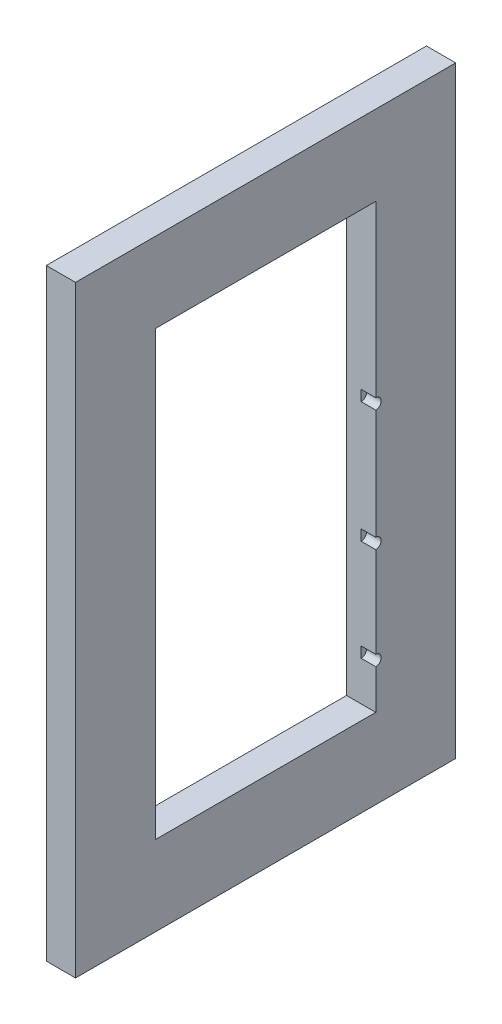
from build123d import *

# Parameters (mm, degrees)
CROQUIS1_W              = 309
CROQUIS1_H              = 195
CROQUIS1_W_2            = 227
CROQUIS1_H_2            = 113
SALIENTE_EXTRUIR1_DEPTH = 15
CROQUIS2_R              = 2.75
CORTAR_EXTRUIR1_DEPTH   = 7.5


with BuildPart() as part:
    # Croquis1 → Saliente-Extruir1 (new body)
    with BuildSketch(Plane.YZ):
        with Locations((154.5, 97.5)):
            Rectangle(CROQUIS1_W, CROQUIS1_H)
        with Locations((154.5, 97.5)):
            Rectangle(CROQUIS1_W_2, CROQUIS1_H_2, mode=Mode.SUBTRACT)
    extrude(amount=SALIENTE_EXTRUIR1_DEPTH)

    # Croquis2 → Cortar-Extruir1 (cut)
    with BuildSketch(Plane.YZ.offset(15)):
        with BuildLine():
            ThreePointArc((66.75, 41), (64, 43.75), (61.25, 41))
            Line((61.25, 41), (66.75, 41))
        make_face()
        with BuildLine():
            Line((66.75, 41), (61.25, 41))
            ThreePointArc((61.25, 41), (64, 38.25), (66.75, 41))
        make_face()
        with Locations((116, 41)):
            Circle(CROQUIS2_R)
        with Locations((178, 41)):
            Circle(CROQUIS2_R)
    extrude(amount=-CORTAR_EXTRUIR1_DEPTH, mode=Mode.SUBTRACT)


solid = part.part
